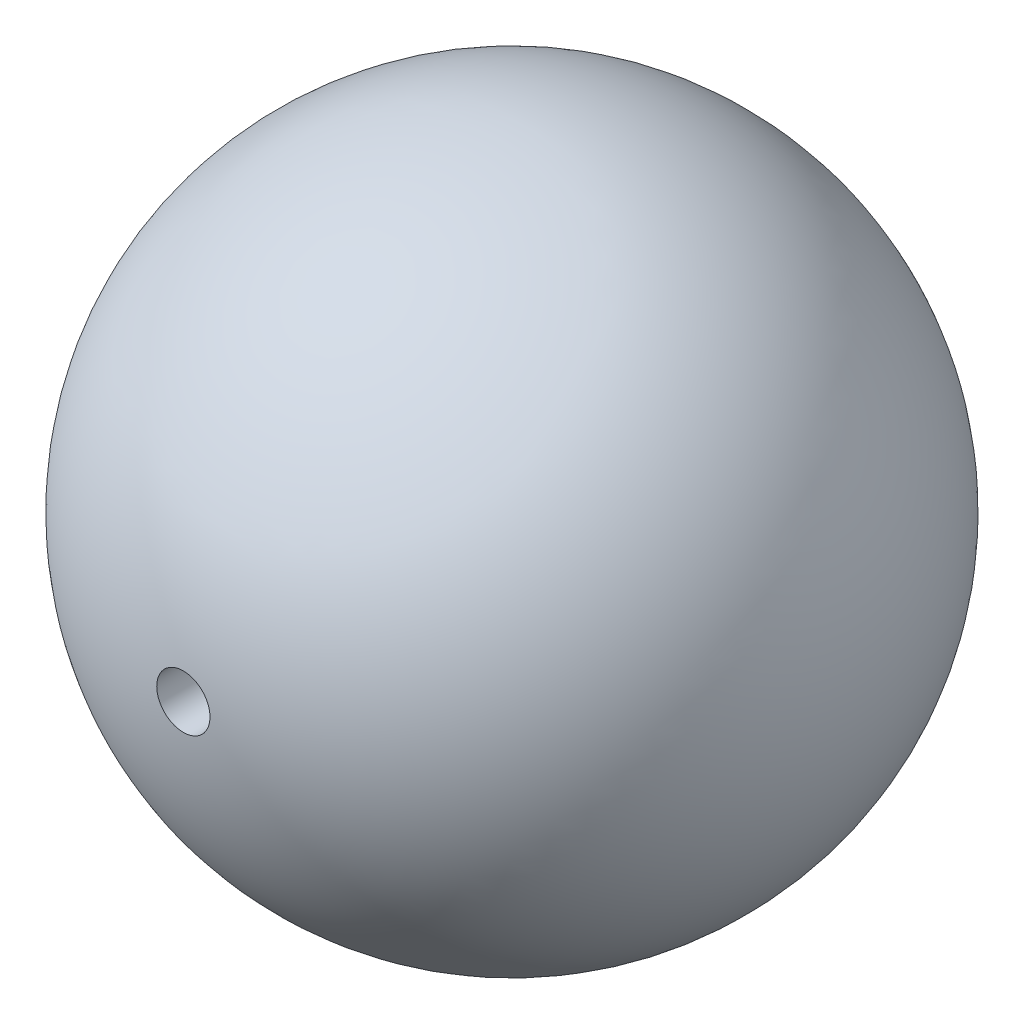
from build123d import *

# Parameters (mm, degrees)
CUT_EXTRUDE_1_DEPTH      = 18.147302995
CUT_EXTRUDE_1_DEPTH_BACK = 18.147302995
SKETCH_3_R               = 0.8


with BuildPart() as part:
    # 草图1 → 旋转1 (revolve)
    with BuildSketch(Plane(origin=(0, 0, 0), x_dir=(1, 0, 0), z_dir=(0, 1, 0))):
        with BuildLine():
            Line((0, 9.9), (0, -9.9))
            ThreePointArc((0, -9.9), (9.9, 0), (0, 9.9))
        make_face()
    revolve(axis=Axis((0, 0, 0), (0, 0, -1)))

    # 草图3 → 切除-拉伸1 (cut, two sides: drawn at the far end of the back side and taken through both)
    with BuildSketch(Plane.XY.offset(-CUT_EXTRUDE_1_DEPTH_BACK)):
        with Locations(Location((0, 0, 0), (0, 0, 180))):
            Circle(SKETCH_3_R)
    extrude(amount=CUT_EXTRUDE_1_DEPTH + CUT_EXTRUDE_1_DEPTH_BACK, mode=Mode.SUBTRACT)


solid = part.part
